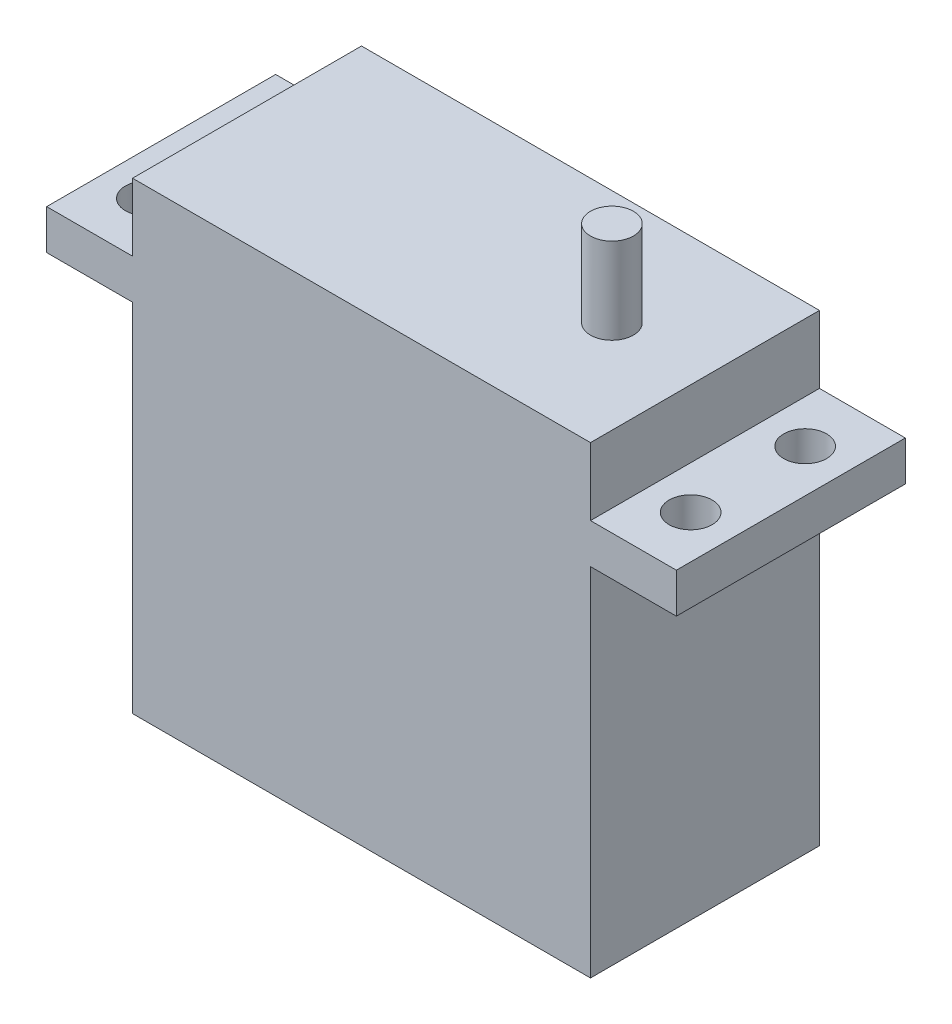
from build123d import *

# Parameters (mm, degrees)
SKETCH1_W                = 40
SKETCH1_H                = 20
BOSS_EXTRUDE1_DEPTH      = 40.5
BOSS_EXTRUDE2_DEPTH      = 7.5
BOSS_EXTRUDE2_DEPTH_BACK = 47.5
SKETCH2_W                = 20
SKETCH2_H                = 3.48
SKETCH3_R                = 1.875
CUT_EXTRUDE1_DEPTH       = 63.075840711
SKETCH4_R                = 1.875
BOSS_EXTRUDE3_DEPTH      = 7.5


with BuildPart() as part:
    # Sketch1 → Boss-Extrude1 (new body)
    with BuildSketch(Plane(origin=(0, 0, 0), x_dir=(1, 0, 0), z_dir=(0, 1, 0))):
        with Locations((20, 10)):
            Rectangle(SKETCH1_W, SKETCH1_H)
    extrude(amount=BOSS_EXTRUDE1_DEPTH)

    # Sketch2 → Boss-Extrude2 (add, two sides: drawn at the far end of the back side and taken through both)
    with BuildSketch(Plane(origin=(40, 0, 0), x_dir=(0, 0, -1), z_dir=(1, 0, 0)).offset(-BOSS_EXTRUDE2_DEPTH_BACK)):
        with Locations((10, 32.86)):
            Rectangle(SKETCH2_W, SKETCH2_H)
    extrude(amount=BOSS_EXTRUDE2_DEPTH + BOSS_EXTRUDE2_DEPTH_BACK)

    # Sketch3 → Cut-Extrude1 (cut, through all)
    with BuildSketch(Plane(origin=(0, 34.6, 0), x_dir=(1, 0, 0), z_dir=(0, 1, 0))):
        with Locations(Location((43.75, 15, 0), (0, 0, 270))):
            Circle(SKETCH3_R)
        with Locations(Location((43.75, 5, 0), (0, 0, 270))):
            Circle(SKETCH3_R)
        with Locations(Location((-3.75, 15, 0), (0, 0, 270))):
            Circle(SKETCH3_R)
        with Locations(Location((-3.75, 5, 0), (0, 0, 270))):
            Circle(SKETCH3_R)
    extrude(amount=-CUT_EXTRUDE1_DEPTH, mode=Mode.SUBTRACT)

    # Sketch4 → Boss-Extrude3 (add)
    with BuildSketch(Plane(origin=(0, 40.5, 0), x_dir=(1, 0, 0), z_dir=(0, 1, 0))):
        with Locations(Location((31.8724, 10, 0), (0, 0, 90))):
            Circle(SKETCH4_R)
    extrude(amount=BOSS_EXTRUDE3_DEPTH)


solid = part.part
